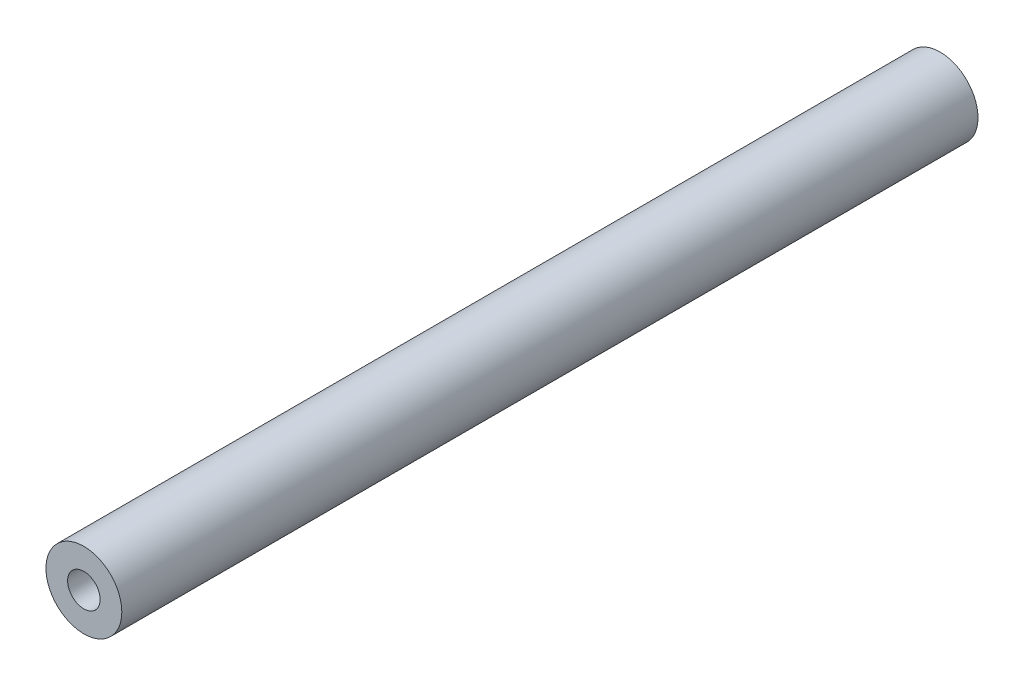
from build123d import *

# Parameters (mm, degrees)
SKETCH_1_R      = 3.5
SKETCH_1_R_2    = 1.5
EXTRUDE_1_DEPTH = 39.5


with BuildPart() as part:
    # 草图1 → 凸台-拉伸1 (new, symmetric)
    with BuildSketch(Plane.XY):
        Circle(SKETCH_1_R)
        Circle(SKETCH_1_R_2, mode=Mode.SUBTRACT)
    extrude(amount=EXTRUDE_1_DEPTH, both=True)


solid = part.part
